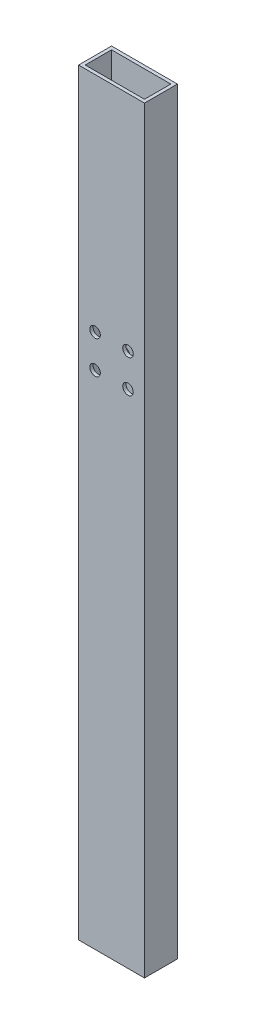
from build123d import *

# Parameters (mm, degrees)
SKETCH_1_W          = 20
SKETCH_1_H          = 10
SKETCH_1_W_2        = 18
SKETCH_1_H_2        = 8
EXTRUDE_1_DEPTH     = 230
SKETCH_3_R          = 1.6
CUT_EXTRUDE_1_DEPTH = 231.434372436


with BuildPart() as part:
    # 草图1 → 拉伸-薄壁1 (new body)
    with BuildSketch(Plane(origin=(0, 0, 0), x_dir=(1, 0, 0), z_dir=(0, 1, 0))):
        Rectangle(SKETCH_1_W, SKETCH_1_H)
        Rectangle(SKETCH_1_W_2, SKETCH_1_H_2, mode=Mode.SUBTRACT)
    extrude(amount=EXTRUDE_1_DEPTH)

    # 草图3 → 切除-拉伸1 (cut, through all)
    with BuildSketch(Plane.XY.offset(5)):
        with Locations((-5, 162.3)):
            Circle(SKETCH_3_R)
        with Locations(Location((-5, 152.3, 0), (0, 0, 180))):
            Circle(SKETCH_3_R)
        with Locations((5, 152.3)):
            Circle(SKETCH_3_R)
        with Locations(Location((5, 162.3, 0), (0, 0, 180))):
            Circle(SKETCH_3_R)
    extrude(amount=-CUT_EXTRUDE_1_DEPTH, mode=Mode.SUBTRACT)


solid = part.part
